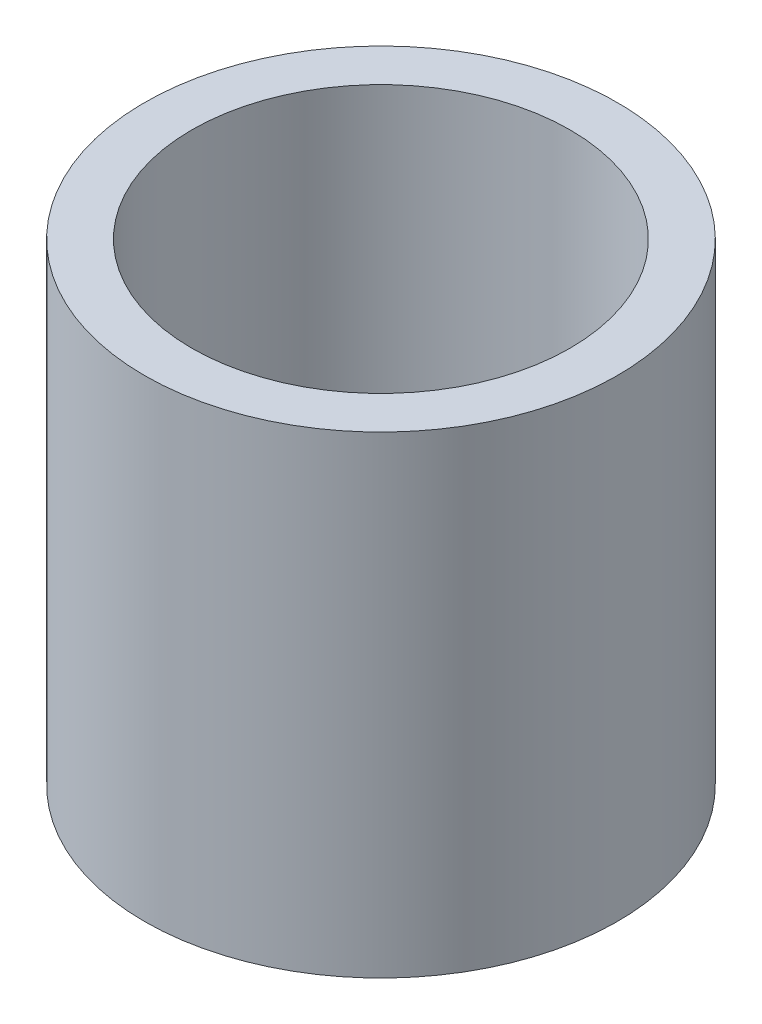
from build123d import *

# Parameters (mm, degrees)
SKETCH1_R           = 5
SKETCH1_R_2         = 4
BOSS_EXTRUDE1_DEPTH = 10


with BuildPart() as part:
    # Sketch1 → Boss-Extrude1 (new body)
    with BuildSketch(Plane(origin=(0, 0, 0), x_dir=(1, 0, 0), z_dir=(0, 1, 0))):
        with Locations(Location((0, 0, 0), (0, 0, 270))):
            Circle(SKETCH1_R)
        with Locations(Location((0, 0, 0), (0, 0, 270))):
            Circle(SKETCH1_R_2, mode=Mode.SUBTRACT)
    extrude(amount=BOSS_EXTRUDE1_DEPTH)


solid = part.part
